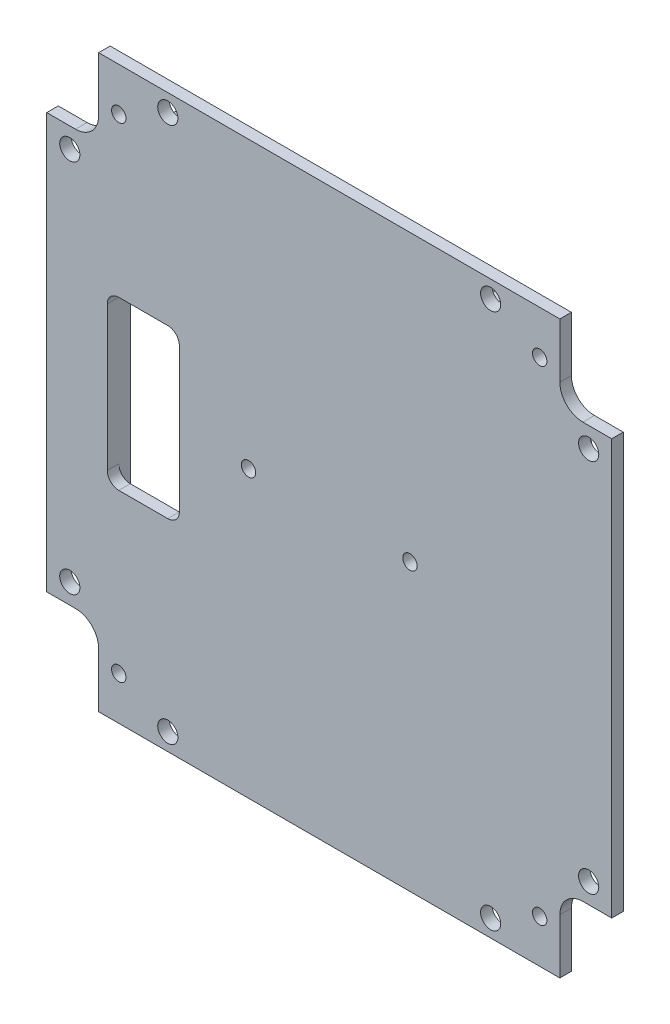
from build123d import *

# Parameters (mm, degrees)
SKETCH1_W                 = 98
SKETCH1_H                 = 99
MAIN_BODY_DEPTH           = 2
SKETCH2_R                 = 1.75
FRONTBACKBOLTHOLES_DEPTH  = 140.316187143
SKETCH3_R                 = 1.75
SIDEBOLTHOLES_DEPTH       = 140.316187143
M3X0_5_TAPPED_HOLE1_D     = 2.5
M3X0_5_TAPPED_HOLE1_DEPTH = 7.5
M3X0_5_TAPPED_HOLE1_TIP   = 0.751075774
SKETCH7_W                 = 9
SKETCH7_H                 = 13.5
CUT_EXTRUDE3_DEPTH        = 140.316187143
FILLET1_R                 = 4
SKETCH8_W                 = 60
SKETCH8_H                 = 3
BOSS_EXTRUDE2_DEPTH       = 2
SKETCH9_W                 = 3
SKETCH9_H                 = 60
BOSS_EXTRUDE3_DEPTH       = 2
CUT_EXTRUDE5_DEPTH        = 140.316187143


with BuildPart() as part:
    # Sketch1 → Main Body (new body)
    with BuildSketch(Plane.XY):
        with Locations((49, 49.5)):
            Rectangle(SKETCH1_W, SKETCH1_H)
    extrude(amount=MAIN_BODY_DEPTH)

    # Sketch2 → FrontBackBoltHoles (cut, through all)
    with BuildSketch(Plane.XY.offset(2)):
        with Locations((4, 82)):
            Circle(SKETCH2_R)
        with Locations((94, 82)):
            Circle(SKETCH2_R)
        with Locations((94, 17)):
            Circle(SKETCH2_R)
        with Locations((4, 17)):
            Circle(SKETCH2_R)
    extrude(amount=-FRONTBACKBOLTHOLES_DEPTH, mode=Mode.SUBTRACT)

    # Sketch3 → SideBoltHoles (cut, through all)
    with BuildSketch(Plane.XY.offset(2)):
        with Locations((21, 96)):
            Circle(SKETCH3_R)
        with Locations((77, 96)):
            Circle(SKETCH3_R)
        with Locations((77, 3)):
            Circle(SKETCH3_R)
        with Locations((21, 3)):
            Circle(SKETCH3_R)
    extrude(amount=-SIDEBOLTHOLES_DEPTH, mode=Mode.SUBTRACT)

    # M3x0.5 Tapped Hole1
    with Locations(Plane.XY.offset(2)):
        with Locations((12.5, 91.5), (85.5, 91.5), (85.5, 7.5), (12.5, 7.5), (35, 49.5), (63, 49.5)):
            Hole(M3X0_5_TAPPED_HOLE1_D / 2, depth=M3X0_5_TAPPED_HOLE1_DEPTH)
            with Locations((0, 0, -(M3X0_5_TAPPED_HOLE1_DEPTH + M3X0_5_TAPPED_HOLE1_TIP / 2))):  # 118° drill point
                Cone(0, M3X0_5_TAPPED_HOLE1_D / 2, M3X0_5_TAPPED_HOLE1_TIP, mode=Mode.SUBTRACT)

    # Sketch7 → Cut-Extrude3 (cut, through all)
    with BuildSketch(Plane.XY.offset(2)):
        with Locations((4.5, 92.25)):
            Rectangle(SKETCH7_W, SKETCH7_H)
        with Locations((93.5, 92.25)):
            Rectangle(SKETCH7_W, SKETCH7_H)
        with Locations((93.5, 6.75)):
            Rectangle(SKETCH7_W, SKETCH7_H)
        with Locations((4.5, 6.75)):
            Rectangle(SKETCH7_W, SKETCH7_H)
    extrude(amount=-CUT_EXTRUDE3_DEPTH, mode=Mode.SUBTRACT)

    # Fillet1
    fillet1_edges = [part.edges().sort_by_distance(p)[0] for p in [
        (89, 85.5, 1),
        (9, 13.5, 1),
        (89, 13.5, 1),
        (9, 85.5, 1),
    ]]
    fillet(fillet1_edges, radius=FILLET1_R)

    # Sketch8 → Boss-Extrude2 (add)
    with BuildSketch(Plane(origin=(0, 0, 0), x_dir=(-1, 0, 0), z_dir=(0, 0, -1))):
        with Locations((-49, 92)):
            Rectangle(SKETCH8_W, SKETCH8_H)
        with Locations((-49, 7)):
            Rectangle(SKETCH8_W, SKETCH8_H)
    extrude(amount=BOSS_EXTRUDE2_DEPTH)

    # Sketch9 → Boss-Extrude3 (add)
    with BuildSketch(Plane(origin=(0, 0, 0), x_dir=(-1, 0, 0), z_dir=(0, 0, -1))):
        with Locations((-89, 49.5)):
            Rectangle(SKETCH9_W, SKETCH9_H)
        with Locations((-9, 49.5)):
            Rectangle(SKETCH9_W, SKETCH9_H)
    extrude(amount=BOSS_EXTRUDE3_DEPTH)

    # Sketch11 → Cut-Extrude5 (cut, through all)
    with BuildSketch(Plane(origin=(0, 0, 0), x_dir=(-1, 0, 0), z_dir=(0, 0, -1))):
        with BuildLine():
            Line((-10.5, 37), (-10.5, 62))
            ThreePointArc((-10.5, 62), (-11.085786438, 63.414213562), (-12.5, 64))
            ThreePointArc((-12.5, 64), (-13.914213562, 63.414213562), (-14.5, 62))
            Line((-14.5, 62), (-14.5, 37))
            ThreePointArc((-14.5, 37), (-13.914213562, 35.585786438), (-12.5, 35))
            ThreePointArc((-12.5, 35), (-11.085786438, 35.585786438), (-10.5, 37))
        make_face()
        with BuildLine():
            ThreePointArc((-14.5, 62), (-13.914213562, 63.414213562), (-12.5, 64))
            Line((-12.5, 64), (-21, 64))
            ThreePointArc((-21, 64), (-19.585786438, 63.414213562), (-19, 62))
            Line((-19, 62), (-19, 37))
            ThreePointArc((-19, 37), (-19.585786438, 35.585786438), (-21, 35))
            Line((-21, 35), (-12.5, 35))
            ThreePointArc((-12.5, 35), (-13.914213562, 35.585786438), (-14.5, 37))
            Line((-14.5, 37), (-14.5, 62))
        make_face()
        with BuildLine():
            Line((-23, 62), (-23, 37))
            ThreePointArc((-23, 37), (-21, 35), (-19, 37))
            Line((-19, 37), (-19, 62))
            ThreePointArc((-19, 62), (-21, 64), (-23, 62))
        make_face()
    extrude(amount=-CUT_EXTRUDE5_DEPTH, mode=Mode.SUBTRACT)


solid = part.part
